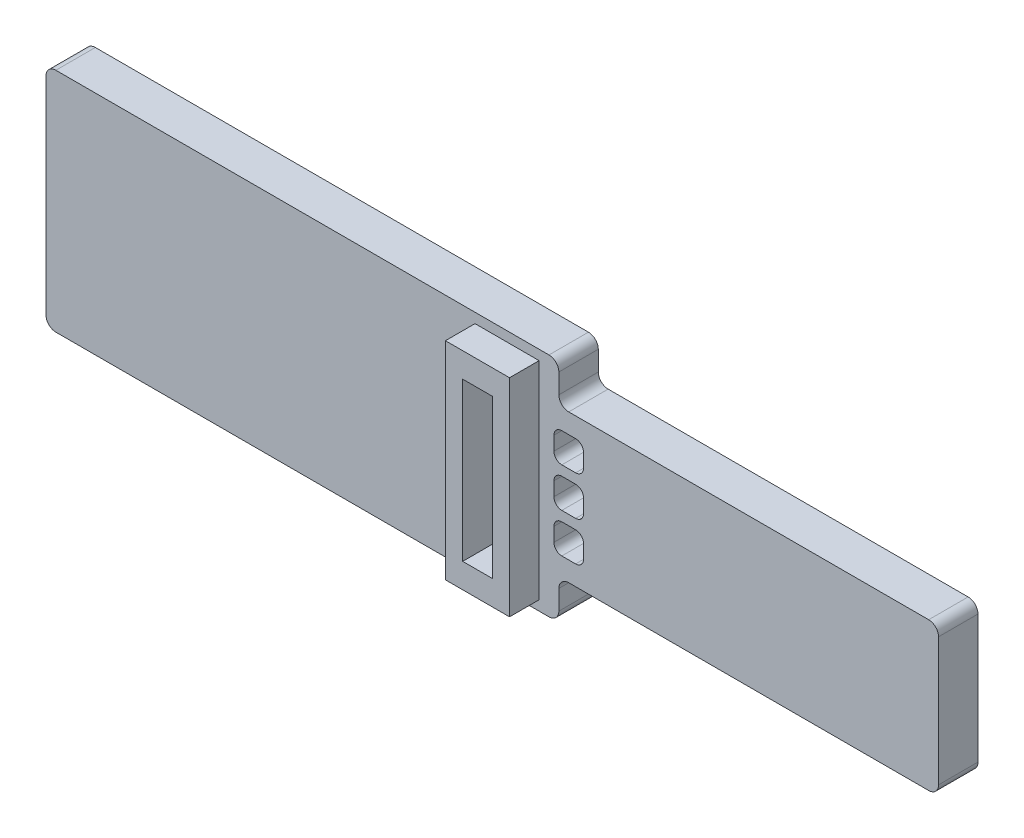
from build123d import *

# Parameters (mm, degrees)
BOSS_EXTRUDE1_DEPTH = 4
FILLET1_R           = 1
SKETCH2_W           = 6.5
SKETCH2_H           = 21
SKETCH2_W_2         = 3
SKETCH2_H_2         = 16
BOSS_EXTRUDE2_DEPTH = 3
CUT_EXTRUDE3_DEPTH  = 94.63893421


with BuildPart() as part:
    # Sketch1 → Boss-Extrude1 (new body)
    with BuildSketch(Plane.XY):
        Polygon((0, 0), (52, 0), (52, 4), (90.5, 4), (90.5, 19), (52, 19), (52, 23), (0, 23), align=None)
    extrude(amount=BOSS_EXTRUDE1_DEPTH)

    # Fillet1
    fillet1_edges = [part.edges().sort_by_distance(p)[0] for p in [
        (0, 23, 2),
        (52, 23, 2),
        (52, 19, 2),
        (90.5, 19, 2),
        (90.5, 4, 2),
        (52, 4, 2),
        (52, 0, 2),
        (0, 0, 2),
    ]]
    fillet(fillet1_edges, radius=FILLET1_R)

    # Sketch2 → Boss-Extrude2 (add)
    with BuildSketch(Plane.XY.offset(4)):
        with Locations((46.75, 11.5)):
            Rectangle(SKETCH2_W, SKETCH2_H)
        with Locations((46.75, 11.5)):
            Rectangle(SKETCH2_W_2, SKETCH2_H_2, mode=Mode.SUBTRACT)
    extrude(amount=BOSS_EXTRUDE2_DEPTH)

    # Sketch3 → Cut-Extrude3 (cut, through all)
    with BuildSketch(Plane(origin=(0, 0, 0), x_dir=(-1, 0, 0), z_dir=(0, 0, -1))):
        with BuildLine():
            Line((-53.7, 14), (-52.3, 14))
            ThreePointArc((-52.3, 14), (-51.734314575, 14.234314575), (-51.5, 14.8))
            Line((-51.5, 14.8), (-51.5, 16.2))
            ThreePointArc((-51.5, 16.2), (-51.734314575, 16.765685425), (-52.3, 17))
            Line((-52.3, 17), (-53.7, 17))
            ThreePointArc((-53.7, 17), (-54.265685425, 16.765685425), (-54.5, 16.2))
            Line((-54.5, 16.2), (-54.5, 14.8))
            ThreePointArc((-54.5, 14.8), (-54.265685425, 14.234314575), (-53.7, 14))
        make_face()
        with BuildLine():
            Line((-52.3, 10), (-53.7, 10))
            ThreePointArc((-53.7, 10), (-54.265685425, 10.234314575), (-54.5, 10.8))
            Line((-54.5, 10.8), (-54.5, 12.2))
            ThreePointArc((-54.5, 12.2), (-54.265685425, 12.765685425), (-53.7, 13))
            Line((-53.7, 13), (-52.3, 13))
            ThreePointArc((-52.3, 13), (-51.734314575, 12.765685425), (-51.5, 12.2))
            Line((-51.5, 12.2), (-51.5, 10.8))
            ThreePointArc((-51.5, 10.8), (-51.734314575, 10.234314575), (-52.3, 10))
        make_face()
        with BuildLine():
            Line((-53.7, 6), (-52.3, 6))
            ThreePointArc((-52.3, 6), (-51.734314575, 6.234314575), (-51.5, 6.8))
            Line((-51.5, 6.8), (-51.5, 8.2))
            ThreePointArc((-51.5, 8.2), (-51.734314575, 8.765685425), (-52.3, 9))
            Line((-52.3, 9), (-53.7, 9))
            ThreePointArc((-53.7, 9), (-54.265685425, 8.765685425), (-54.5, 8.2))
            Line((-54.5, 8.2), (-54.5, 6.8))
            ThreePointArc((-54.5, 6.8), (-54.265685425, 6.234314575), (-53.7, 6))
        make_face()
    extrude(amount=-CUT_EXTRUDE3_DEPTH, mode=Mode.SUBTRACT)


solid = part.part
